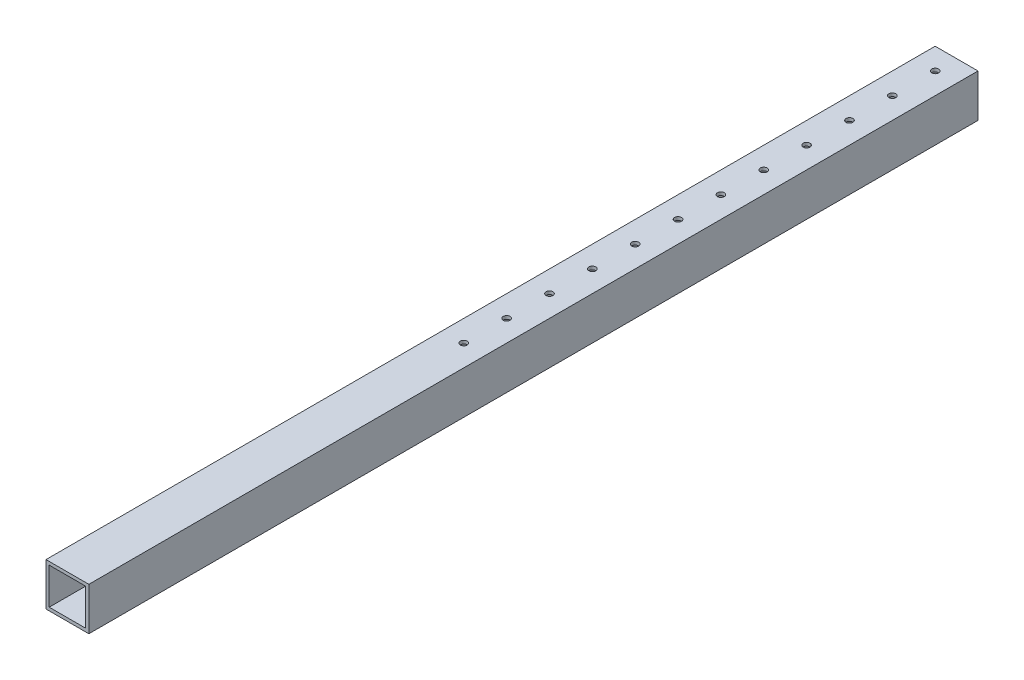
from build123d import *

# Parameters (mm, degrees)
SKETCH_1_W          = 20
SKETCH_1_H          = 20
SKETCH_1_W_2        = 17
SKETCH_1_H_2        = 17
EXTRUDE_1_DEPTH     = 415
SKETCH_5_R          = 1.6
CUT_EXTRUDE_4_DEPTH = 416.601973046


with BuildPart() as part:
    # 草图1 → 凸台-拉伸1 (new body)
    with BuildSketch(Plane.XY):
        Rectangle(SKETCH_1_W, SKETCH_1_H)
        Rectangle(SKETCH_1_W_2, SKETCH_1_H_2, mode=Mode.SUBTRACT)
    extrude(amount=EXTRUDE_1_DEPTH)

    # 草图5 → 切除-拉伸4 (cut, through all)
    with BuildSketch(Plane.XZ.offset(10)):
        with Locations(Location((0, 10, 0), (0, 0, 270))):
            Circle(SKETCH_5_R)
        with Locations(Location((0, 30, 0), (0, 0, 270))):
            Circle(SKETCH_5_R)
        with Locations(Location((0, 50, 0), (0, 0, 270))):
            Circle(SKETCH_5_R)
        with Locations(Location((0, 70, 0), (0, 0, 270))):
            Circle(SKETCH_5_R)
        with Locations(Location((0, 90, 0), (0, 0, 270))):
            Circle(SKETCH_5_R)
        with Locations(Location((0, 110, 0), (0, 0, 270))):
            Circle(SKETCH_5_R)
        with Locations(Location((0, 130, 0), (0, 0, 270))):
            Circle(SKETCH_5_R)
        with Locations(Location((0, 150, 0), (0, 0, 270))):
            Circle(SKETCH_5_R)
        with Locations(Location((0, 170, 0), (0, 0, 270))):
            Circle(SKETCH_5_R)
        with Locations(Location((0, 190, 0), (0, 0, 270))):
            Circle(SKETCH_5_R)
        with Locations(Location((0, 210, 0), (0, 0, 270))):
            Circle(SKETCH_5_R)
        with Locations(Location((0, 230, 0), (0, 0, 270))):
            Circle(SKETCH_5_R)
    extrude(amount=-CUT_EXTRUDE_4_DEPTH, mode=Mode.SUBTRACT)


solid = part.part
